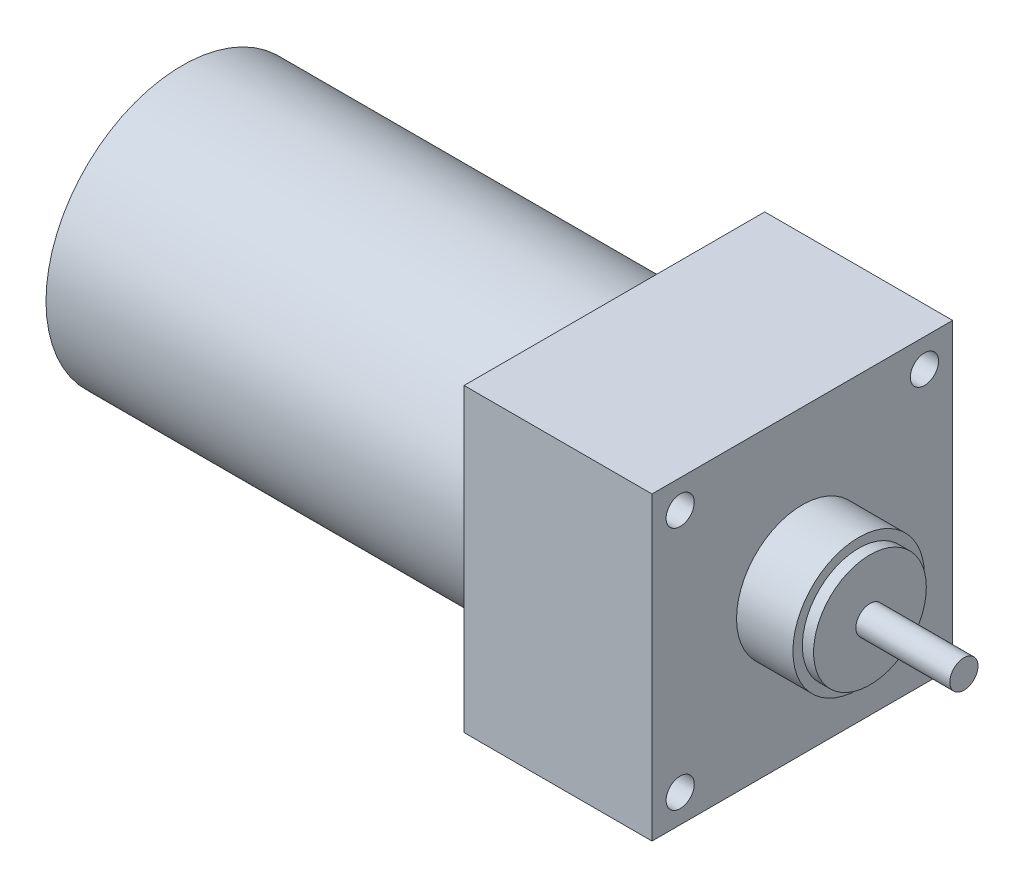
from build123d import *

# Parameters (mm, degrees)
SKETCH1_W           = 32
SKETCH1_H           = 32
BOSS_EXTRUDE2_DEPTH = 20
SKETCH2_R           = 14.5
BOSS_EXTRUDE3_DEPTH = 46
SKETCH3_R           = 7
BOSS_EXTRUDE4_DEPTH = 6
SKETCH6_R           = 6
BOSS_EXTRUDE5_DEPTH = 1.2
SKETCH7_R           = 1.5
BOSS_EXTRUDE6_DEPTH = 10
CUT_EXTRUDE5_DEPTH  = 20


with BuildPart() as part:
    # Sketch1 → Boss-Extrude2 (new body)
    with BuildSketch(Plane(origin=(0, 0, 0), x_dir=(0, 0, -1), z_dir=(1, 0, 0))):
        Rectangle(SKETCH1_W, SKETCH1_H)
    extrude(amount=BOSS_EXTRUDE2_DEPTH)

    # Sketch2 → Boss-Extrude3 (add)
    with BuildSketch(Plane.ZY):
        Circle(SKETCH2_R)
    extrude(amount=BOSS_EXTRUDE3_DEPTH)

    # Sketch3 → Boss-Extrude4 (add)
    with BuildSketch(Plane(origin=(20, 0, 0), x_dir=(0, 0, -1), z_dir=(1, 0, 0))):
        with Locations(Location((0, 0, 0), (0, 0, 180))):
            Circle(SKETCH3_R)
    extrude(amount=BOSS_EXTRUDE4_DEPTH)

    # Sketch6 → Boss-Extrude5 (add)
    with BuildSketch(Plane(origin=(26, 0, 0), x_dir=(0, 0, -1), z_dir=(1, 0, 0))):
        Circle(SKETCH6_R)
    extrude(amount=BOSS_EXTRUDE5_DEPTH)

    # Sketch7 → Boss-Extrude6 (add)
    with BuildSketch(Plane(origin=(27.2, 0, 0), x_dir=(0, 0, -1), z_dir=(1, 0, 0))):
        Circle(SKETCH7_R)
    extrude(amount=BOSS_EXTRUDE6_DEPTH)

    # Sketch8 → Cut-Extrude5 (cut)
    with BuildSketch(Plane(origin=(20, 0, 0), x_dir=(0, 0, -1), z_dir=(1, 0, 0))):
        with BuildLine():
            ThreePointArc((-14.5, -13), (-14.060660172, -14.060660172), (-13, -14.5))
            Line((-13, -14.5), (-13, -13))
            Line((-13, -13), (-14.5, -13))
        make_face()
        with BuildLine():
            Line((-13, -13), (-13, -14.5))
            ThreePointArc((-13, -14.5), (-11.939339828, -14.060660172), (-11.5, -13))
            ThreePointArc((-11.5, -13), (-13, -11.5), (-14.5, -13))
            Line((-14.5, -13), (-13, -13))
        make_face()
        with BuildLine():
            ThreePointArc((14.5, -13), (11.939339828, -11.939339828), (13, -14.5))
            Line((13, -14.5), (13, -13))
            Line((13, -13), (14.5, -13))
        make_face()
        with BuildLine():
            Line((13, -13), (13, -14.5))
            ThreePointArc((13, -14.5), (14.060660172, -14.060660172), (14.5, -13))
            Line((14.5, -13), (13, -13))
        make_face()
        with BuildLine():
            ThreePointArc((14.5, 13), (14.060660172, 14.060660172), (13, 14.5))
            Line((13, 14.5), (13, 13))
            Line((13, 13), (14.5, 13))
        make_face()
        with BuildLine():
            Line((13, 13), (13, 14.5))
            ThreePointArc((13, 14.5), (11.939339828, 11.939339828), (14.5, 13))
            Line((14.5, 13), (13, 13))
        make_face()
        with BuildLine():
            ThreePointArc((-11.5, 13), (-11.939339828, 14.060660172), (-13, 14.5))
            Line((-13, 14.5), (-13, 13))
            Line((-13, 13), (-14.5, 13))
            ThreePointArc((-14.5, 13), (-13, 11.5), (-11.5, 13))
        make_face()
        with BuildLine():
            Line((-13, 13), (-13, 14.5))
            ThreePointArc((-13, 14.5), (-14.060660172, 14.060660172), (-14.5, 13))
            Line((-14.5, 13), (-13, 13))
        make_face()
    extrude(amount=-CUT_EXTRUDE5_DEPTH, mode=Mode.SUBTRACT)


solid = part.part
